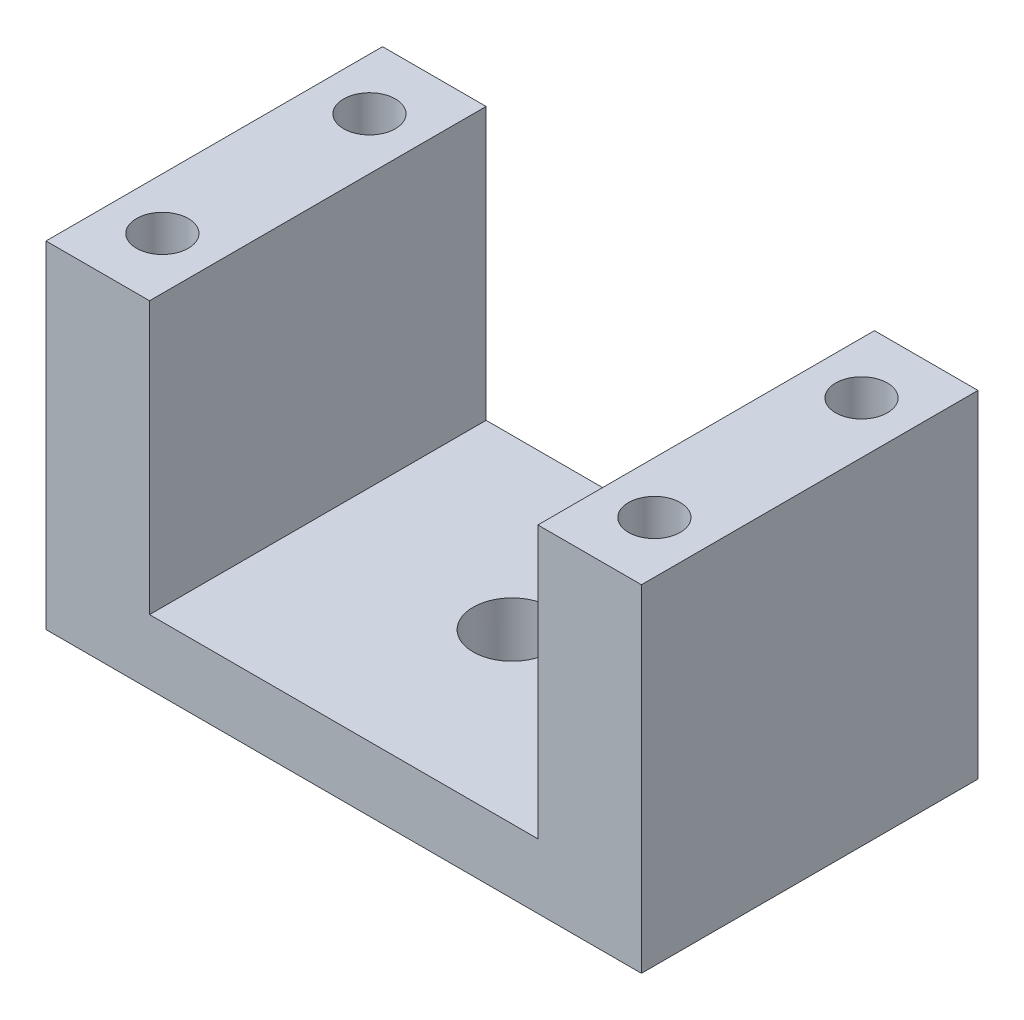
from build123d import *

# Parameters (mm, degrees)
EXTRUDE_1_DEPTH     = 13
SKETCH_2_R          = 1
SKETCH_2_R_2        = 1.5
CUT_EXTRUDE_1_DEPTH = 22.685248442


with BuildPart() as part:
    # 草图1 → 凸台-拉伸1 (new body)
    with BuildSketch(Plane.XY):
        Polygon((-7.5, 6.5), (-7.5, -4), (7.5, -4), (7.5, 6.5), (11.5, 6.5), (11.5, -6.5), (-11.5, -6.5), (-11.5, 6.5), align=None)
    extrude(amount=EXTRUDE_1_DEPTH)

    # 草图2 → 切除-拉伸1 (cut, through all)
    with BuildSketch(Plane(origin=(0, 6.5, 0), x_dir=(1, 0, 0), z_dir=(0, 1, 0))):
        with Locations(Location((-9.504895382, -2.5, 0), (0, 0, 270))):
            Circle(SKETCH_2_R)
        with Locations(Location((-9.504895382, -10.5, 0), (0, 0, 270))):
            Circle(SKETCH_2_R)
        with Locations(Location((9.5, -2.5, 0), (0, 0, 270))):
            Circle(SKETCH_2_R)
        with Locations(Location((9.5, -10.5, 0), (0, 0, 270))):
            Circle(SKETCH_2_R)
        with Locations(Location((0, -6.5, 0), (0, 0, 270))):
            Circle(SKETCH_2_R_2)
    extrude(amount=-CUT_EXTRUDE_1_DEPTH, mode=Mode.SUBTRACT)


solid = part.part
